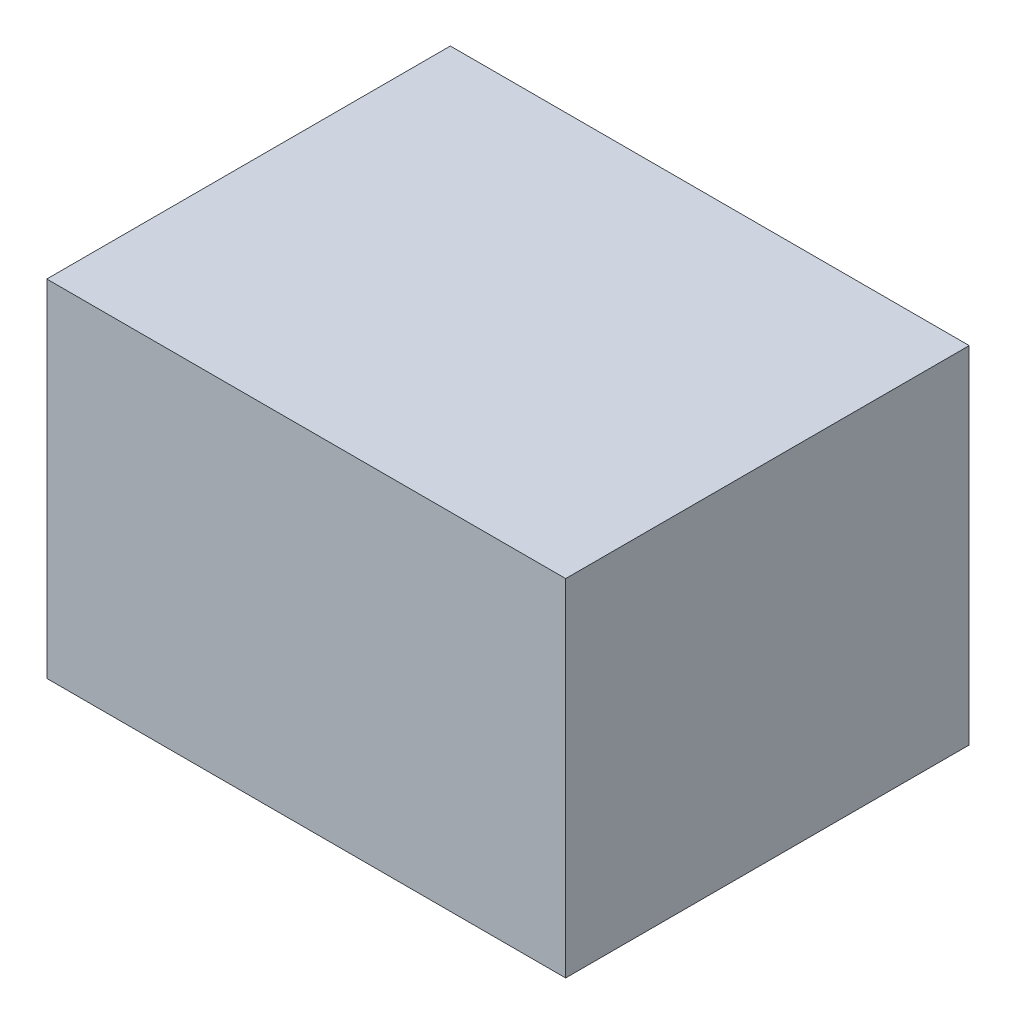
from build123d import *

# Parameters (mm, degrees)
ESQUISSE1_W        = 45
ESQUISSE1_H        = 30
BOSS_EXTRU_1_DEPTH = 35


with BuildPart() as part:
    # Esquisse1 → Boss.-Extru.1 (new body)
    with BuildSketch(Plane.XY):
        Rectangle(ESQUISSE1_W, ESQUISSE1_H)
    extrude(amount=BOSS_EXTRU_1_DEPTH)


solid = part.part
